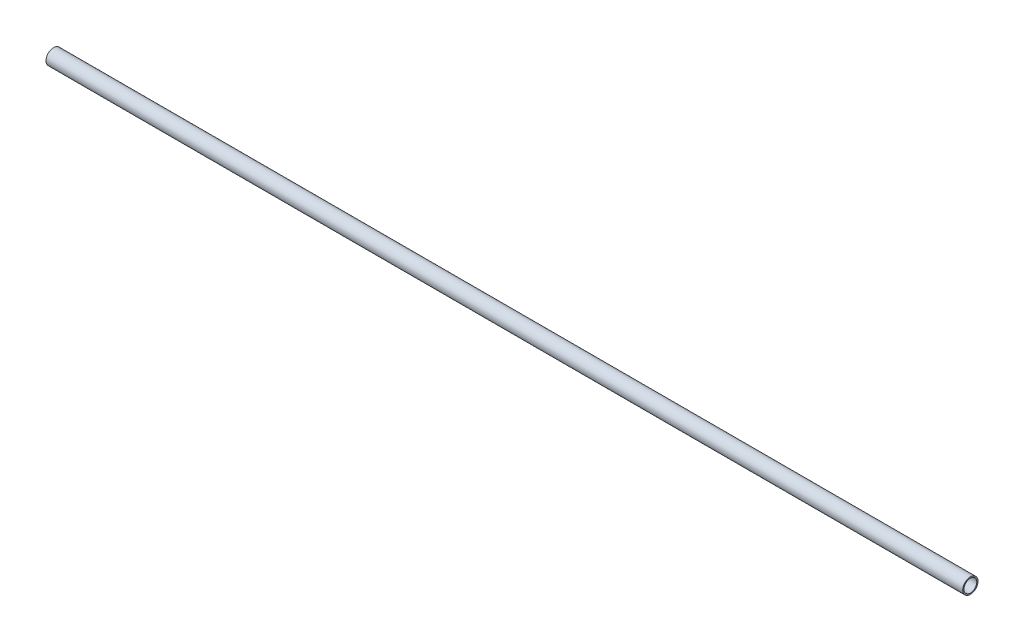
from build123d import *

# Parameters (mm, degrees)
CROQUIS1_R              = 12.5
CROQUIS1_R_2            = 10.5
SALIENTE_EXTRUIR1_DEPTH = 1500


with BuildPart() as part:
    # Croquis1 → Saliente-Extruir1 (new body)
    with BuildSketch(Plane(origin=(0, 0, 0), x_dir=(0, 0, -1), z_dir=(1, 0, 0))):
        Circle(CROQUIS1_R)
        Circle(CROQUIS1_R_2, mode=Mode.SUBTRACT)
    extrude(amount=SALIENTE_EXTRUIR1_DEPTH)


solid = part.part
